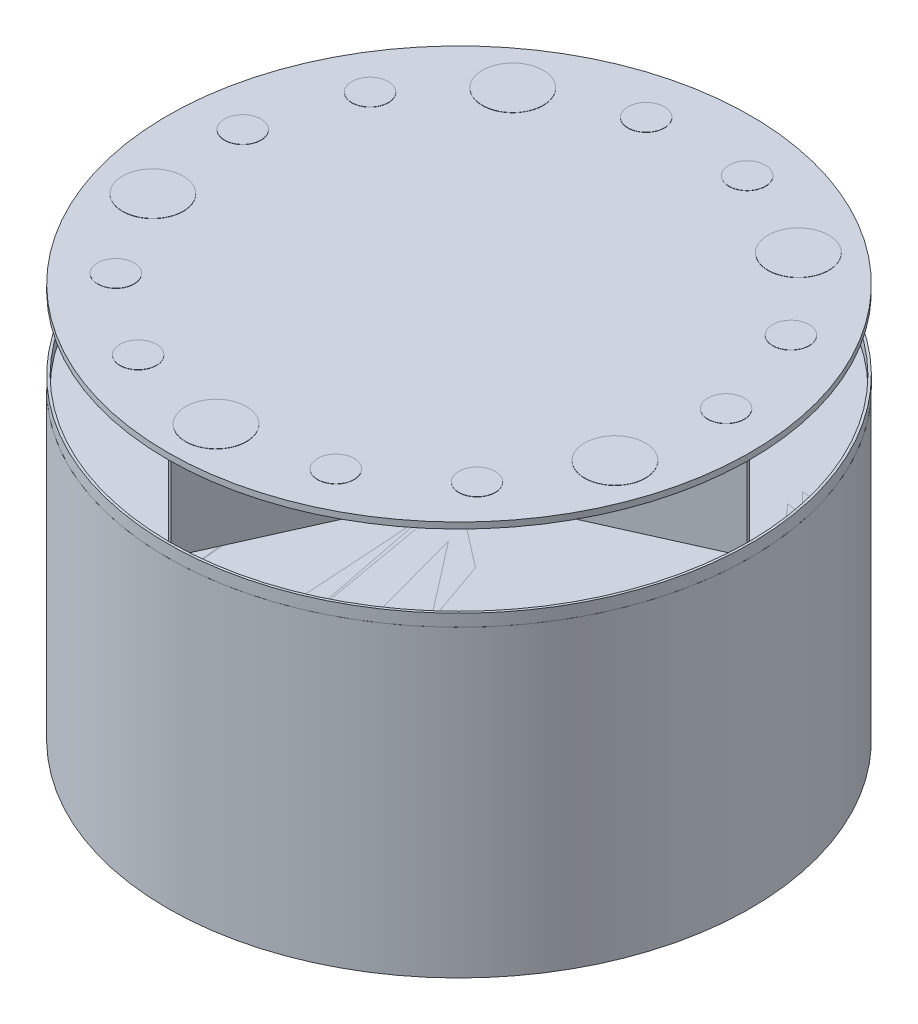
from build123d import *

# Parameters (mm, degrees)
SKETCH1_R            = 304.8
BOSS_EXTRUDE1_DEPTH  = 28.575
SKETCH2_W            = 50.8
SKETCH2_H            = 50.8
BOSS_EXTRUDE2_DEPTH  = 63.5
SKETCH3_R            = 304.8
BOSS_EXTRUDE3_DEPTH  = 225.425
BOSS_EXTRUDE8_DEPTH  = 88.9
SKETCH10_R           = 304.8
BOSS_EXTRUDE11_DEPTH = 6.35
SKETCH11_R           = 304.8
SKETCH11_R_2         = 302.26
BOSS_EXTRUDE12_DEPTH = 12.7
BOSS_EXTRUDE10_REACH = 537.362
SKETCH9_R            = 304.81653601
SKETCH9_R_2          = 298.178711987
SKETCH12_R           = 31.75
SKETCH12_R_2         = 19.05
BOSS_EXTRUDE13_DEPTH = 0.254
CIRPATTERN1_COUNT    = 5


with BuildPart() as part:
    # Sketch1 → Boss-Extrude1 (new body)
    with BuildSketch(Plane(origin=(0, 0, 0), x_dir=(1, 0, 0), z_dir=(0, 1, 0))):
        with Locations(Location((0, 0, 0), (0, 0, 270))):
            Circle(SKETCH1_R)
    extrude(amount=BOSS_EXTRUDE1_DEPTH)

    # Sketch2 → Boss-Extrude2 (add)
    with BuildSketch(Plane(origin=(0, 28.575, 0), x_dir=(1, 0, 0), z_dir=(0, 1, 0))):
        Polygon((245.765281759, 171.222045256), (201.771191247, 145.822045256), (227.171191247, 101.827954744), (271.165281759, 127.227954744), align=None)
        with Locations((0, 273.05)):
            Rectangle(SKETCH2_W, SKETCH2_H)
        Polygon((271.165281759, -127.227954744), (227.171191247, -101.827954744), (201.771191247, -145.822045256), (245.765281759, -171.222045256), align=None)
        with Locations((0, -273.05)):
            Rectangle(SKETCH2_W, SKETCH2_H)
        Polygon((-245.765281759, -171.222045256), (-201.771191247, -145.822045256), (-227.171191247, -101.827954744), (-271.165281759, -127.227954744), align=None)
        Polygon((-271.165281759, 127.227954744), (-227.171191247, 101.827954744), (-201.771191247, 145.822045256), (-245.765281759, 171.222045256), align=None)
    extrude(amount=BOSS_EXTRUDE2_DEPTH)

    # Sketch3 → Boss-Extrude3 (add)
    with BuildSketch(Plane(origin=(0, 92.075, 0), x_dir=(1, 0, 0), z_dir=(0, 1, 0))):
        with Locations(Location((0, 0, 0), (0, 0, 270))):
            Circle(SKETCH3_R)
    extrude(amount=BOSS_EXTRUDE3_DEPTH)

    # Sketch6 → Boss-Extrude8 (add)
    with BuildSketch(Plane(origin=(0, 317.5, 0), x_dir=(1, 0, 0), z_dir=(0, 1, 0))):
        Polygon((94.292689271, 94.292689271), (302.26, 1.27), (302.26, -1.27), (94.292689271, -94.292689271), (1.27, -302.26), (-1.27, -302.26), (-94.292689271, -94.292689271), (-302.26, -1.27), (-302.26, 1.27), (-94.292689271, 94.292689271), (-1.27, 302.26), (1.27, 302.26), align=None)
    extrude(amount=BOSS_EXTRUDE8_DEPTH)

    # Sketch10 → Boss-Extrude11 (add)
    with BuildSketch(Plane(origin=(0, 406.4, 0), x_dir=(1, 0, 0), z_dir=(0, 1, 0))):
        with Locations(Location((0, 0, 0), (0, 0, 270))):
            Circle(SKETCH10_R)
    extrude(amount=BOSS_EXTRUDE11_DEPTH)

    # Sketch11 → Boss-Extrude12 (add)
    with BuildSketch(Plane(origin=(0, 317.5, 0), x_dir=(1, 0, 0), z_dir=(0, 1, 0))):
        with Locations(Location((0, 0, 0), (0, 0, 270))):
            Circle(SKETCH11_R)
        Circle(SKETCH11_R_2, mode=Mode.SUBTRACT)
    extrude(amount=BOSS_EXTRUDE12_DEPTH)

    # Boss-Extrude10: up to this face of the body (flat: up to its plane)
    boss_extrude10_end = Plane(part.part.faces().sort_by_distance((0, 0, 0))[0])
    # Sketch9 → Boss-Extrude10 (add, up to the picked face)
    with BuildSketch(Plane(origin=(0, 317.5, 0), x_dir=(1, 0, 0), z_dir=(0, 1, 0)), mode=Mode.PRIVATE) as boss_extrude10_sk1:
        with Locations(Location((0, 0, 0), (0, 0, 270))):
            Circle(SKETCH9_R)
        Circle(SKETCH9_R_2, mode=Mode.SUBTRACT)
    boss_extrude10_tool1 = split(extrude(boss_extrude10_sk1.sketch, amount=-BOSS_EXTRUDE10_REACH, mode=Mode.PRIVATE), bisect_by=boss_extrude10_end, keep=Keep.BOTH, mode=Mode.PRIVATE)
    add(boss_extrude10_tool1.solids().sort_by(Axis((0, 317.5, -303.954385), (0, -1, 0)))[0])

    # Sketch12 → Boss-Extrude13 (add)
    with BuildSketch(Plane(origin=(0, 412.75, 0), x_dir=(1, 0, 0), z_dir=(0, 1, 0))):
        with Locations(Location((0, -254, 0), (0, 0, 270))):
            Circle(SKETCH12_R)
        with Locations(Location((103.311107341, -232.040546241, 0), (0, 0, 270))):
            Circle(SKETCH12_R_2)
        with Locations(Location((188.758785671, -169.959174015, 0), (0, 0, 270))):
            Circle(SKETCH12_R_2)
    boss_extrude13 = extrude(amount=BOSS_EXTRUDE13_DEPTH)

    # CirPattern1: Boss-Extrude13 ×5 about axis
    cirpattern1_axis = Axis((0, 0, 0), (0, 1, 0))
    for i in range(1, CIRPATTERN1_COUNT):
        add(boss_extrude13.rotate(cirpattern1_axis, i * 360 / CIRPATTERN1_COUNT))


solid = part.part
